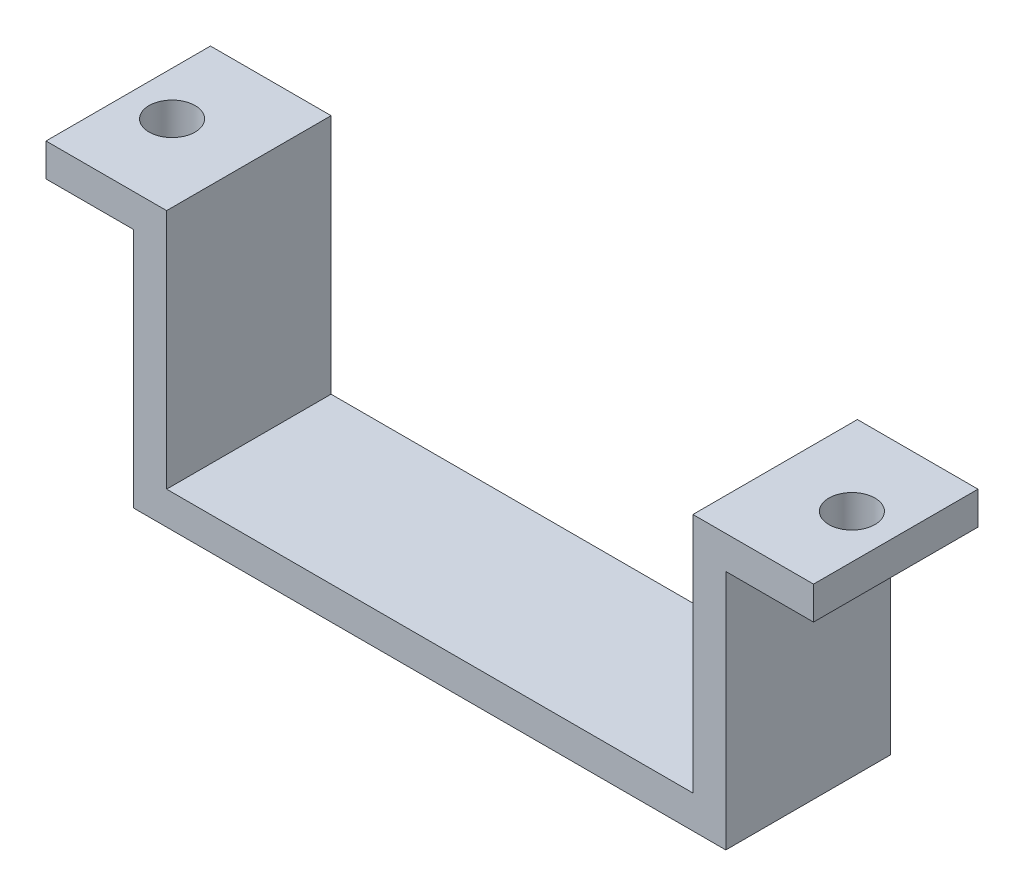
from build123d import *

# Parameters (mm, degrees)
SKETCH_1_W          = 48
SKETCH_1_H          = 15
EXTRUDE_1_DEPTH     = 3
SKETCH_2_W          = 3
SKETCH_2_H          = 15
EXTRUDE_2_DEPTH     = 25
SKETCH_3_W          = 15
SKETCH_3_H          = 3
EXTRUDE_3_DEPTH     = 8
SKETCH_4_R          = 2.1
CUT_EXTRUDE_3_DEPTH = 100


with BuildPart() as part:
    # 草图1 → 凸台-拉伸1 (new body)
    with BuildSketch(Plane(origin=(0, 0, 0), x_dir=(1, 0, 0), z_dir=(0, 1, 0))):
        Rectangle(SKETCH_1_W, SKETCH_1_H)
    extrude(amount=EXTRUDE_1_DEPTH)

    # 草图2 → 凸台-拉伸2 (add)
    with BuildSketch(Plane(origin=(0, 0, 0), x_dir=(1, 0, 0), z_dir=(0, 1, 0))):
        with Locations((25.5, 0)):
            Rectangle(SKETCH_2_W, SKETCH_2_H)
        with Locations((-25.5, 0)):
            Rectangle(SKETCH_2_W, SKETCH_2_H)
    extrude(amount=EXTRUDE_2_DEPTH)

    # 草图3 → 凸台-拉伸3 (add)
    with BuildSketch(Plane(origin=(27, 0, 0), x_dir=(0, 0, -1), z_dir=(1, 0, 0))):
        with Locations((0, 23.5)):
            Rectangle(SKETCH_3_W, SKETCH_3_H)
    extrude_3 = extrude(amount=EXTRUDE_3_DEPTH)

    # 镜向1: 凸台-拉伸3 across plane
    add(extrude_3.mirror(Plane(origin=(0, 0, 0), x_dir=(0, 0, 1), z_dir=(1, 0, 0))))

    # 草图4 → 切除-拉伸3 (cut)
    with BuildSketch(Plane(origin=(0, 0, 0), x_dir=(1, 0, 0), z_dir=(0, 1, 0))):
        with Locations(Location((-31, 0, 0), (0, 0, 90))):
            Circle(SKETCH_4_R)
    cut_extrude_3 = extrude(amount=CUT_EXTRUDE_3_DEPTH, mode=Mode.SUBTRACT)

    # 镜向2: 切除-拉伸3 across plane
    add(cut_extrude_3.mirror(Plane(origin=(0, 0, 0), x_dir=(0, 0, 1), z_dir=(1, 0, 0))), mode=Mode.SUBTRACT)


solid = part.part
